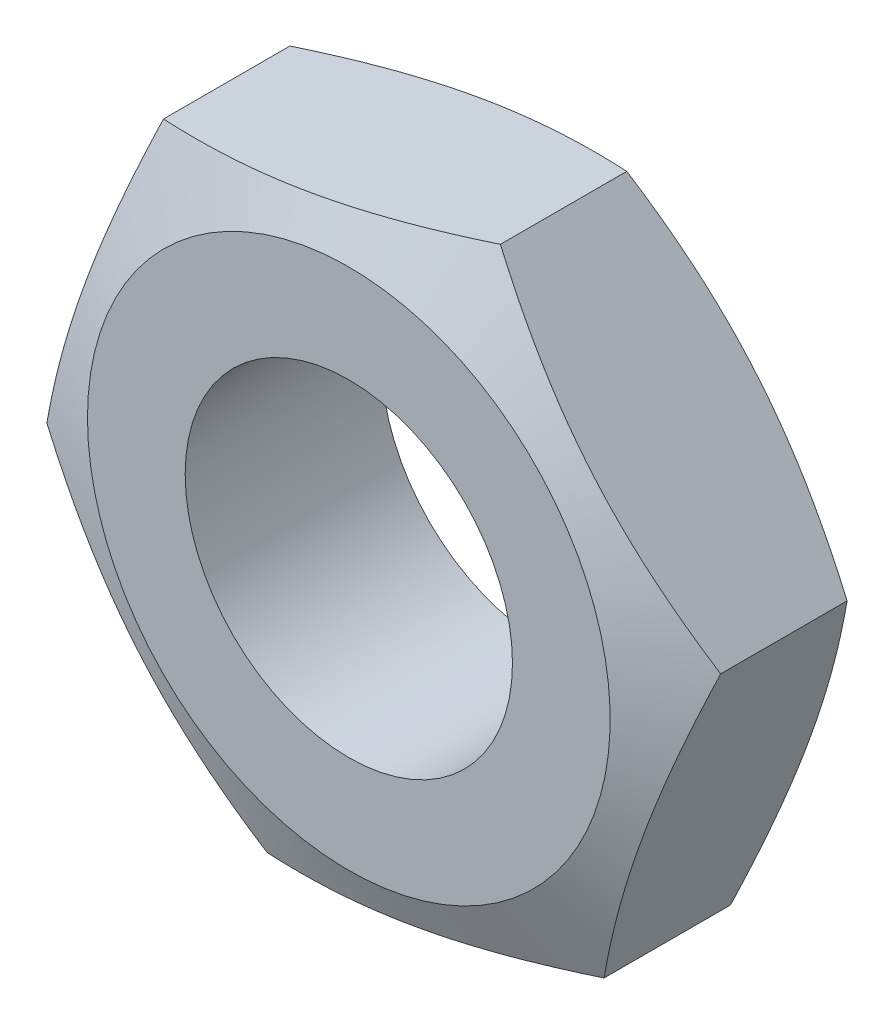
from build123d import *

# Parameters (mm, degrees)
SKETCH_1_R      = 1.25
EXTRUDE_1_DEPTH = 1.5


with BuildPart() as part:
    # 草图1 → 凸台-拉伸1 (new body)
    with BuildSketch(Plane.XY):
        Polygon((-0.890615534, -2.457408644), (1.682870546, -2), (2.573486081, 0.457408644), (0.890615534, 2.457408644), (-1.682870546, 2), (-2.573486081, -0.457408644), align=None)
        Circle(SKETCH_1_R, mode=Mode.SUBTRACT)
    extrude(amount=EXTRUDE_1_DEPTH)

    # 草图3 → 切除-旋转1 (revolve, cut)
    with BuildSketch(Plane(origin=(0, 0, 0), x_dir=(1, 0, 0), z_dir=(0, 1, 0)), mode=Mode.PRIVATE) as cut_revolve_1_sk:
        Polygon((1.996433862, -1.5), (2.573486081, -1.5), (2.704394407, -1.5), (2.704394407, -1.193613078), align=None)
    cut_revolve_1 = revolve(cut_revolve_1_sk.sketch.rotate(Axis((0, 0, 0), (0, 0, 1)), 180), axis=Axis((0, 0, 0), (0, 0, 1)), mode=Mode.SUBTRACT)

    # 镜向1: 切除-旋转1 across plane
    add(cut_revolve_1.mirror(Plane.XY.offset(0.75)), mode=Mode.SUBTRACT)


solid = part.part
